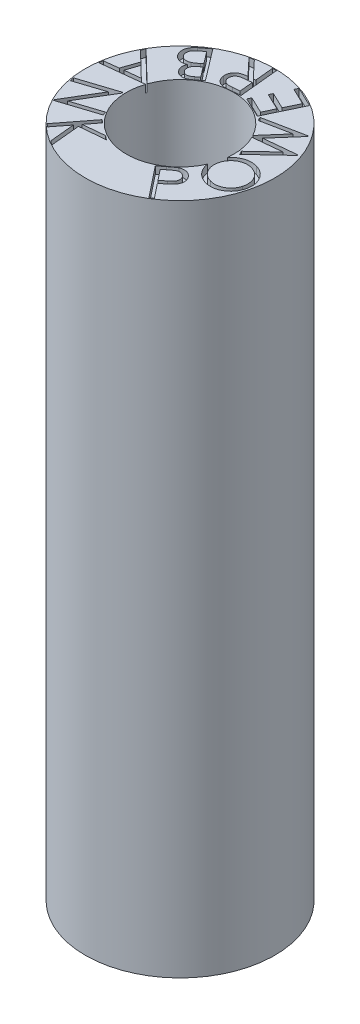
from build123d import *

# Parameters (mm, degrees)
SKETCH1_R           = 3.8
SKETCH1_R_2         = 2.15
BOSS_EXTRUDE1_DEPTH = 27
CUT_EXTRUDE1_DEPTH  = 0.3


with BuildPart() as part:
    # Sketch1 → Boss-Extrude1 (new body)
    with BuildSketch(Plane(origin=(0, 0, 0), x_dir=(1, 0, 0), z_dir=(0, 1, 0))):
        with Locations(Location((0, 0, 0), (0, 0, 270))):
            Circle(SKETCH1_R)
        with Locations(Location((0, 0, 0), (0, 0, 270))):
            Circle(SKETCH1_R_2, mode=Mode.SUBTRACT)
    extrude(amount=BOSS_EXTRUDE1_DEPTH)

    # Sketch2 → Cut-Extrude1 (cut)
    # profile 1 of 9: a face of its own
    with BuildSketch(Plane(origin=(0, 27, 0), x_dir=(1, 0, 0), z_dir=(0, 1, 0))):
        with BuildLine():
            Line((0.982599904, -1.975870203), (1.230010761, -1.779976773))
            add(Edge.make_bspline(
                [(1.230010761, -1.779976773), (1.247051234, -1.766587183), (1.279729012, -1.740910545), (1.327004922, -1.704612222), (1.370644199, -1.672468555), (1.410264244, -1.644230104), (1.445895741, -1.619720543), (1.478034561, -1.599923074), (1.505861087, -1.583259967), (1.523687275, -1.574647201), (1.531801126, -1.570726973)],
                knots=[0, 0, 0, 0, 1.413883867, 2.711343957, 3.888449571, 4.94965571, 5.885716208, 6.708955534, 7.412362121, 8, 8, 8, 8], degree=3))
            add(Edge.make_bspline(
                [(1.531801126, -1.570726973), (1.542328452, -1.566089426), (1.563168837, -1.556908721), (1.595357915, -1.546523319), (1.627697408, -1.538829943), (1.660129737, -1.533777576), (1.6926634, -1.531089349), (1.725317946, -1.531554419), (1.758191511, -1.534341979), (1.79107691, -1.540045365), (1.823554365, -1.54860258), (1.855140485, -1.560144548), (1.885834692, -1.574362326), (1.915130717, -1.592143045), (1.943627311, -1.612422109), (1.970594397, -1.63624137), (1.996835944, -1.662618737), (2.012985941, -1.682007144), (2.021216691, -1.691888332)],
                knots=[0, 0, 0, 0, 1.00932523, 1.998107322, 2.964163901, 3.924962196, 4.877068583, 5.826305595, 6.788454908, 7.77064651, 8.752529476, 9.732823634, 10.719457675, 11.716915946, 12.737036861, 13.785788324, 14.871540088, 16, 16, 16, 16], degree=3))
            add(Edge.make_bspline(
                [(2.021216691, -1.691888332), (2.028988571, -1.702176572), (2.044260055, -1.722392621), (2.064303432, -1.75377069), (2.081013992, -1.785622358), (2.094674391, -1.817614801), (2.105407903, -1.85002966), (2.112518448, -1.882773675), (2.117296917, -1.915719439), (2.117991836, -1.948865619), (2.116180753, -1.981847305), (2.111345647, -2.014513871), (2.103687557, -2.04675535), (2.09308674, -2.07863779), (2.079841435, -2.110259274), (2.062957927, -2.14103182), (2.044090823, -2.171769674), (2.029338133, -2.191174536), (2.021852709, -2.201020443)],
                knots=[0, 0, 0, 0, 1.115566439, 2.192050712, 3.217897653, 4.224908718, 5.199646254, 6.167799991, 7.121371145, 8.075824419, 9.031467262, 9.977240287, 10.929575101, 11.895596865, 12.882134228, 13.891774298, 14.930299329, 16, 16, 16, 16], degree=3))
            add(Edge.make_bspline(
                [(2.021852709, -2.201020443), (2.015364222, -2.208833028), (2.001159455, -2.225936546), (1.976086303, -2.252028454), (1.946704976, -2.281835345), (1.911253074, -2.313686567), (1.871542258, -2.349399542), (1.82606825, -2.387422746), (1.775868896, -2.428823), (1.74045305, -2.457170234), (1.721970397, -2.471963953)],
                knots=[0, 0, 0, 0, 0.601907002, 1.31771065, 2.144265435, 3.082768872, 4.142231728, 5.310615985, 6.596477089, 8, 8, 8, 8], degree=3))
            Line((1.721970397, -2.471963953), (1.633245938, -2.542243901))
            Line((1.633245938, -2.542243901), (2.09117863, -3.120065916))
            Line((2.09117863, -3.120065916), (1.967155193, -3.218330639))
            Line((1.967155193, -3.218330639), (0.982599904, -1.975870203))
        make_face()
        with BuildLine():
            Line((1.202025986, -1.99813082), (1.536889267, -2.420764534))
            Line((1.536889267, -2.420764534), (1.749637164, -2.256353977))
            add(Edge.make_bspline(
                [(1.749637164, -2.256353977), (1.759872858, -2.248157073), (1.779613722, -2.232348283), (1.807185936, -2.208350426), (1.832543606, -2.185803693), (1.855065385, -2.164074316), (1.874570833, -2.142931176), (1.891342989, -2.122911204), (1.906022819, -2.104215579), (1.920948975, -2.08021305), (1.935997936, -2.050442628), (1.946987383, -2.013147228), (1.952675768, -1.97501122), (1.951846399, -1.936278338), (1.945541681, -1.89793025), (1.933713057, -1.860878749), (1.915981135, -1.825815336), (1.900567234, -1.804482486), (1.89274113, -1.793651152)],
                knots=[0, 0, 0, 0, 1.139873163, 2.198393126, 3.177215439, 4.089579485, 4.917780684, 5.676465855, 6.360265572, 6.981531816, 8.131381771, 9.247958655, 10.346594315, 11.471015432, 12.601199469, 13.714463005, 14.839563645, 16, 16, 16, 16], degree=3))
            add(Edge.make_bspline(
                [(1.89274113, -1.793651152), (1.884210815, -1.783745089), (1.867318286, -1.764128175), (1.837435845, -1.739439859), (1.804149627, -1.719926418), (1.768538757, -1.705049855), (1.731478098, -1.695536256), (1.694050164, -1.691447377), (1.656822077, -1.693885321), (1.625835629, -1.700463996), (1.600661562, -1.709467365), (1.5797867, -1.718293668), (1.557770839, -1.730493714), (1.533380631, -1.743782888), (1.508102005, -1.760764586), (1.480632105, -1.779457231), (1.451459367, -1.800631122), (1.431888334, -1.816154424), (1.421770076, -1.824179998)],
                knots=[0, 0, 0, 0, 1.163675189, 2.30441857, 3.435417202, 4.591704879, 5.732878559, 6.834692946, 7.932652339, 9.044547579, 9.645144927, 10.313819024, 11.061881929, 11.886891351, 12.788369302, 13.773726171, 14.849012606, 16, 16, 16, 16], degree=3))
            Line((1.421770076, -1.824179998), (1.202025986, -1.99813082))
        make_face(mode=Mode.SUBTRACT)
    # profile 2 of 9: a face of its own
    with BuildSketch(Plane(origin=(0, 27, 0), x_dir=(1, 0, 0), z_dir=(0, 1, 0))):
        with BuildLine():
            add(Edge.make_bspline(
                [(1.991625351, -0.545622572), (2.000029357, -0.517572681), (2.016551357, -0.462427514), (2.049527824, -0.383893473), (2.088825292, -0.311007785), (2.134128025, -0.243434975), (2.185945006, -0.181421387), (2.244034803, -0.124953951), (2.308442278, -0.074092273), (2.378336094, -0.029402458), (2.451863405, 0.00901634), (2.527743993, 0.039347343), (2.604997417, 0.061435436), (2.683498362, 0.075734827), (2.763577881, 0.080760678), (2.844849129, 0.078774923), (2.927527378, 0.067842414), (2.982115872, 0.054546574), (3.009889574, 0.047781875)],
                knots=[0, 0, 0, 0, 1.067886113, 2.099429174, 3.101456462, 4.085191214, 5.062785548, 6.044754578, 7.036041568, 8.052094896, 9.06759591, 10.058784797, 11.02840403, 11.995009833, 12.964220099, 13.950908388, 14.957456868, 16, 16, 16, 16], degree=3))
            add(Edge.make_bspline(
                [(3.009889574, 0.047781875), (3.03700362, 0.039736451), (3.090545533, 0.02384921), (3.166523183, -0.009032875), (3.237774605, -0.047505066), (3.303539387, -0.092851789), (3.36397452, -0.144850815), (3.419578162, -0.202834876), (3.469625465, -0.26757456), (3.514074443, -0.337649641), (3.552028479, -0.411507989), (3.582379884, -0.48742697), (3.604951087, -0.564481394), (3.619015248, -0.642940264), (3.624754596, -0.722679083), (3.621967363, -0.803508701), (3.611656875, -0.885568999), (3.598526459, -0.939740034), (3.591845703, -0.967302259)],
                knots=[0, 0, 0, 0, 1.041056618, 2.055766994, 3.043057983, 4.0200634, 4.992100927, 5.975329371, 6.974350292, 8.001309033, 9.028200955, 10.028868942, 11.008843004, 11.980849157, 12.95960101, 13.948034232, 14.955959693, 16, 16, 16, 16], degree=3))
            add(Edge.make_bspline(
                [(3.591845703, -0.967302259), (3.583678808, -0.994728104), (3.567589279, -1.048759522), (3.534688258, -1.125653479), (3.496086636, -1.197555188), (3.450357932, -1.26382278), (3.398920417, -1.325185098), (3.340455785, -1.380756054), (3.275897094, -1.431205555), (3.205835026, -1.475825358), (3.132322539, -1.514241928), (3.056689648, -1.544637056), (2.979947732, -1.566695966), (2.902281685, -1.580803222), (2.823529963, -1.586860363), (2.743745655, -1.584873503), (2.662694395, -1.574876932), (2.609299937, -1.561685653), (2.582167719, -1.554982548)],
                knots=[0, 0, 0, 0, 1.054990574, 2.078427706, 3.079381257, 4.061080641, 5.043519763, 6.028229129, 7.031159441, 8.061766972, 9.088523752, 10.087067861, 11.063675181, 12.029447946, 12.994365175, 13.972341833, 14.969652202, 16, 16, 16, 16], degree=3))
            add(Edge.make_bspline(
                [(2.582167719, -1.554982548), (2.564182401, -1.549686505), (2.528399125, -1.539149591), (2.47638303, -1.519643636), (2.426046305, -1.497514804), (2.378187852, -1.47134727), (2.33141038, -1.443414354), (2.287292204, -1.411173359), (2.244614622, -1.376704061), (2.204249421, -1.339179998), (2.166674551, -1.299148579), (2.131398801, -1.257645643), (2.100071329, -1.213768089), (2.071145417, -1.168693413), (2.046109396, -1.121462251), (2.024204811, -1.072639114), (2.004841822, -1.022338362), (1.989567138, -0.970250311), (1.977055529, -0.91753225), (1.968486773, -0.864382029), (1.963380092, -0.811270579), (1.961780681, -0.758046731), (1.963713606, -0.704825912), (1.969080267, -0.65158414), (1.978274246, -0.598347012), (1.987155684, -0.563273597), (1.991625351, -0.545622572)],
                knots=[0, 0, 0, 0, 1.037223879, 2.0636427, 3.07200055, 4.077162655, 5.080182888, 6.084642962, 7.097902888, 8.114823864, 9.131474103, 10.13490593, 11.126418924, 12.112607806, 13.096718421, 14.081266011, 15.072674885, 16.076723787, 17.082707158, 18.069262339, 19.053372954, 20.033436706, 21.013693544, 21.998380925, 22.992666418, 24, 24, 24, 24], degree=3))
        make_face()
        with BuildLine():
            add(Edge.make_bspline(
                [(2.142361529, -0.578695489), (2.138917172, -0.592758374), (2.132068585, -0.620720318), (2.12463227, -0.663175701), (2.120595632, -0.705917293), (2.119298316, -0.748834937), (2.120913688, -0.791966899), (2.125393292, -0.835305236), (2.132731895, -0.878849248), (2.142820851, -0.922324395), (2.155919662, -0.964939045), (2.171001606, -1.006531245), (2.189294511, -1.046235679), (2.209779385, -1.084503059), (2.232105152, -1.121603234), (2.257931433, -1.156497525), (2.285480471, -1.19038513), (2.315722115, -1.222412629), (2.347977646, -1.252520845), (2.382226676, -1.280300223), (2.418120198, -1.305893437), (2.456219035, -1.328565679), (2.495509696, -1.349914851), (2.537160346, -1.367832461), (2.580340182, -1.383869255), (2.610094135, -1.392552998), (2.625098909, -1.396932167)],
                knots=[0, 0, 0, 0, 0.986307279, 1.961124446, 2.933450286, 3.908882607, 4.884555534, 5.871972775, 6.875268522, 7.891350228, 8.910328257, 9.911177508, 10.90339024, 11.885616924, 12.86787016, 13.850203048, 14.840600441, 15.842022812, 16.84871812, 17.844708724, 18.844645517, 19.849162277, 20.863677045, 21.888855731, 22.935360235, 24, 24, 24, 24], degree=3))
            add(Edge.make_bspline(
                [(2.625098909, -1.396932167), (2.647381534, -1.402333714), (2.691284386, -1.412976235), (2.757671289, -1.421493498), (2.823063639, -1.4234185), (2.887444231, -1.419084756), (2.950772971, -1.407889639), (3.012967024, -1.389835899), (3.074070356, -1.36525046), (3.133502045, -1.334455534), (3.189976722, -1.298703258), (3.241728453, -1.258075213), (3.288405159, -1.213703199), (3.330095937, -1.165515553), (3.36619129, -1.112955313), (3.396997447, -1.056418912), (3.42318061, -0.996018619), (3.435914455, -0.9535644), (3.442381561, -0.932003281)],
                knots=[0, 0, 0, 0, 1.050771129, 2.070305873, 3.06234356, 4.046586185, 5.023951091, 6.005453226, 7.010986874, 8.039290383, 9.07085151, 10.071438491, 11.051314355, 12.019839642, 12.98792571, 13.969018521, 14.968530496, 16, 16, 16, 16], degree=3))
            add(Edge.make_bspline(
                [(3.442381561, -0.932003281), (3.446032457, -0.917304195), (3.453267363, -0.888175321), (3.461366852, -0.84414396), (3.466011743, -0.800135794), (3.468108431, -0.756154586), (3.466578257, -0.71229491), (3.462984573, -0.668493787), (3.455861128, -0.624955062), (3.445962927, -0.581764341), (3.433693096, -0.539344496), (3.41875013, -0.498055531), (3.400819162, -0.458456959), (3.380940317, -0.420153326), (3.358098605, -0.383719043), (3.332910009, -0.34868476), (3.305380681, -0.314934852), (3.274963536, -0.283184774), (3.242797641, -0.253112041), (3.208687664, -0.22522247), (3.172476396, -0.200291973), (3.135146838, -0.176705676), (3.095371903, -0.15666756), (3.054381765, -0.137960971), (3.011433396, -0.122036784), (2.981858228, -0.113576656), (2.966958384, -0.109314479)],
                knots=[0, 0, 0, 0, 1.02870095, 2.03855539, 3.038088597, 4.032707763, 5.026805504, 6.017062342, 7.016180482, 8.020577878, 9.025491356, 10.014097524, 11.000367087, 11.976278497, 12.943330417, 13.918497749, 14.905923179, 15.899107766, 16.902782203, 17.895784059, 18.888577038, 19.887695178, 20.89247966, 21.910923103, 22.947531944, 24, 24, 24, 24], degree=3))
            add(Edge.make_bspline(
                [(2.966958384, -0.109314479), (2.951947292, -0.10552321), (2.922315677, -0.098039316), (2.877478259, -0.090154278), (2.833097776, -0.084900467), (2.7889954, -0.083208188), (2.745335781, -0.083624096), (2.702055312, -0.087420672), (2.659217929, -0.094693577), (2.616768971, -0.104017919), (2.575081808, -0.116390193), (2.534742039, -0.13182531), (2.495332139, -0.149302838), (2.457182213, -0.169549178), (2.420554529, -0.193083258), (2.384888635, -0.218638895), (2.350833066, -0.2472927), (2.317768125, -0.277727466), (2.287351526, -0.310891332), (2.258357392, -0.344747321), (2.232703571, -0.38055563), (2.209405974, -0.417488035), (2.188588176, -0.455796396), (2.170637796, -0.495509243), (2.154726629, -0.536413121), (2.146504241, -0.564529514), (2.142361529, -0.578695489)],
                knots=[0, 0, 0, 0, 1.055413227, 2.083366083, 3.101898403, 4.100329543, 5.090695658, 6.077547342, 7.059090479, 8.051643504, 9.039606358, 10.020963176, 10.994864818, 11.977897238, 12.962469754, 13.961554788, 14.967544972, 15.995497828, 17.023450684, 18.034078404, 19.033163438, 20.023846031, 21.010300565, 22.003327224, 22.994009817, 24, 24, 24, 24], degree=3))
        make_face(mode=Mode.SUBTRACT)
    # profile 3 of 9: a face of its own
    with BuildSketch(Plane(origin=(0, 27, 0), x_dir=(1, 0, 0), z_dir=(0, 1, 0))):
        Polygon((2.27424535, 0.115541608), (2.199513278, 0.2595996), (3.062907209, 1.068932032), (1.843025398, 0.947452665), (1.828078983, 0.976073458), (2.633277301, 1.897981011), (1.471273094, 1.66488055), (1.39717704, 1.807984516), (3.009163719, 2.132671515), (3.022838098, 2.105958775), (2.176616644, 1.139847998), (3.458510173, 1.265461479), (3.472502561, 1.238748739), align=None)
    # profile 4 of 9: a face of its own
    with BuildSketch(Plane(origin=(0, 27, 0), x_dir=(1, 0, 0), z_dir=(0, 1, 0))):
        Polygon((1.301422849, 1.795635619), (0.488910329, 2.184878408), (0.55569218, 2.324802286), (1.226690778, 2.003295375), (1.439120666, 2.446599662), (0.773846227, 2.765244494), (0.840310069, 2.903896337), (1.505584508, 2.585251505), (1.772075894, 3.141448921), (1.106801455, 3.460093752), (1.173901315, 3.600017631), (1.980689676, 3.213636922), align=None)
    # profile 5 of 9: a face of its own
    with BuildSketch(Plane(origin=(0, 27, 0), x_dir=(1, 0, 0), z_dir=(0, 1, 0))):
        with BuildLine():
            Line((0.256054447, 2.189451149), (-0.05845627, 2.159240311))
            add(Edge.make_bspline(
                [(-0.05845627, 2.159240311), (-0.079544801, 2.157257518), (-0.119898659, 2.153463353), (-0.177800801, 2.149204328), (-0.230352051, 2.145304325), (-0.277771643, 2.143795127), (-0.320062307, 2.142028123), (-0.357178554, 2.14259876), (-0.389038708, 2.143457747), (-0.408379723, 2.145563083), (-0.417170212, 2.146519959)],
                knots=[0, 0, 0, 0, 1.414142958, 2.706026452, 3.876381837, 4.931762058, 5.873475607, 6.701556143, 7.409857397, 8, 8, 8, 8], degree=3))
            add(Edge.make_bspline(
                [(-0.417170212, 2.146519959), (-0.428969513, 2.148360913), (-0.452204304, 2.15198606), (-0.486134782, 2.160358811), (-0.518625537, 2.171078357), (-0.549574941, 2.18462309), (-0.579332527, 2.200186887), (-0.607672551, 2.218331378), (-0.634496419, 2.239079734), (-0.659464107, 2.262304079), (-0.682761265, 2.287317284), (-0.703550085, 2.314392131), (-0.721324836, 2.343495954), (-0.736649512, 2.374282009), (-0.749761465, 2.406639231), (-0.759977215, 2.440919812), (-0.767220104, 2.477040936), (-0.770219867, 2.501817621), (-0.77175004, 2.514456157)],
                knots=[0, 0, 0, 0, 1.0323829, 2.032933993, 3.018591072, 3.987609034, 4.951278431, 5.920166292, 6.893856332, 7.879939641, 8.86602295, 9.846979274, 10.826520974, 11.810471285, 12.818261775, 13.842102474, 14.899260941, 16, 16, 16, 16], degree=3))
            add(Edge.make_bspline(
                [(-0.77175004, 2.514456157), (-0.773079018, 2.53544478), (-0.775668157, 2.57633518), (-0.769631376, 2.63662407), (-0.756081318, 2.693652279), (-0.73429861, 2.747171055), (-0.70488299, 2.796351428), (-0.668403437, 2.840752518), (-0.624336115, 2.879183282), (-0.582525822, 2.906711718), (-0.545195291, 2.925962604), (-0.513993627, 2.939370853), (-0.479747685, 2.950914509), (-0.442873868, 2.961819384), (-0.403047972, 2.971248923), (-0.360526221, 2.979555275), (-0.315070988, 2.986114006), (-0.28382855, 2.98964647), (-0.26770607, 2.991469378)],
                knots=[0, 0, 0, 0, 1.277757329, 2.489348895, 3.670344165, 4.833239091, 5.990163471, 7.144568493, 8.31429276, 9.534214924, 10.180336012, 10.867964698, 11.598131506, 12.37772245, 13.206776199, 14.087098475, 15.012858157, 16, 16, 16, 16], degree=3))
            Line((-0.26770607, 2.991469378), (-0.90594976, 3.671372222))
            Line((-0.90594976, 3.671372222), (-0.710692348, 3.690134742))
            Line((-0.710692348, 3.690134742), (-0.073402684, 3.010231898))
            Line((-0.073402684, 3.010231898), (0.016911819, 3.019136145))
            Line((0.016911819, 3.019136145), (-0.053686138, 3.753418496))
            Line((-0.053686138, 3.753418496), (0.104046234, 3.768364911))
            Line((0.104046234, 3.768364911), (0.256054447, 2.189451149))
        make_face()
        with BuildLine():
            Line((0.083375661, 2.329057018), (0.031858233, 2.865855896))
            Line((0.031858233, 2.865855896), (-0.240039303, 2.841687226))
            add(Edge.make_bspline(
                [(-0.240039303, 2.841687226), (-0.252768685, 2.840384453), (-0.277310657, 2.837872734), (-0.312716218, 2.83301846), (-0.345550649, 2.827823979), (-0.375692955, 2.821248798), (-0.403403373, 2.814865834), (-0.428378915, 2.807222302), (-0.450503272, 2.798633752), (-0.476343469, 2.786952974), (-0.504865129, 2.769568314), (-0.534836838, 2.744538031), (-0.560310271, 2.715307181), (-0.580523496, 2.682090723), (-0.595861459, 2.646316695), (-0.60523749, 2.608633447), (-0.61019935, 2.569678218), (-0.608514422, 2.543402196), (-0.607657492, 2.530038589)],
                knots=[0, 0, 0, 0, 1.117569786, 2.154650176, 3.121219888, 4.020097284, 4.848756641, 5.604365246, 6.299030225, 6.920481635, 8.079658492, 9.203500793, 10.319266467, 11.449915272, 12.586651313, 13.704987924, 14.832789842, 16, 16, 16, 16], degree=3))
            add(Edge.make_bspline(
                [(-0.607657492, 2.530038589), (-0.605956779, 2.517120892), (-0.60259401, 2.491579121), (-0.59025015, 2.455103676), (-0.573856537, 2.420574573), (-0.551715788, 2.389301684), (-0.525975333, 2.361407548), (-0.496579468, 2.338115859), (-0.464274513, 2.319902969), (-0.43485406, 2.308862848), (-0.408985658, 2.302438023), (-0.386496947, 2.299234957), (-0.361258796, 2.296594635), (-0.333332937, 2.295421473), (-0.302575228, 2.295571015), (-0.26905649, 2.29642911), (-0.23269706, 2.298796574), (-0.207598649, 2.300922296), (-0.194564042, 2.302026269)],
                knots=[0, 0, 0, 0, 1.159246882, 2.292143801, 3.416649949, 4.557288627, 5.694239844, 6.791073478, 7.887296006, 8.98807327, 9.581840358, 10.260960452, 11.011511311, 11.844172728, 12.751593703, 13.753938893, 14.833530805, 16, 16, 16, 16], degree=3))
            Line((-0.194564042, 2.302026269), (0.083375661, 2.329057018))
        make_face(mode=Mode.SUBTRACT)
    # profile 6 of 9: a face of its own
    with BuildSketch(Plane(origin=(0, 27, 0), x_dir=(1, 0, 0), z_dir=(0, 1, 0))):
        with BuildLine():
            Line((-0.969720371, 1.985847912), (-1.217449237, 1.797268685))
            add(Edge.make_bspline(
                [(-1.217449237, 1.797268685), (-1.229705269, 1.788203749), (-1.253474487, 1.770623307), (-1.288783394, 1.745897543), (-1.323038259, 1.724389682), (-1.355933218, 1.705518877), (-1.387347699, 1.689168169), (-1.417516441, 1.675795621), (-1.446402692, 1.665135443), (-1.482752766, 1.654607945), (-1.527472842, 1.647214345), (-1.580837317, 1.646148483), (-1.633603793, 1.653213558), (-1.685081378, 1.668269673), (-1.734127903, 1.69041423), (-1.779127312, 1.71980801), (-1.820712714, 1.754806126), (-1.843711471, 1.782980504), (-1.855374918, 1.797268685)],
                knots=[0, 0, 0, 0, 1.010632805, 1.960010575, 2.856905371, 3.6910918, 4.473716387, 5.203674972, 5.877336505, 6.513480752, 7.710404592, 8.870151813, 10.039969142, 11.225387519, 12.414196528, 13.593537457, 14.779601425, 16, 16, 16, 16], degree=3))
            add(Edge.make_bspline(
                [(-1.855374918, 1.797268685), (-1.865317574, 1.8113313), (-1.884961832, 1.839115588), (-1.907111374, 1.884634272), (-1.923053361, 1.931958262), (-1.931914482, 1.981117646), (-1.933916724, 2.031672296), (-1.928213713, 2.082768093), (-1.915960664, 2.134494191), (-1.901984607, 2.16760254), (-1.894808011, 2.18460342)],
                knots=[0, 0, 0, 0, 1.006543515, 1.988683871, 2.949951783, 3.92097901, 4.901864634, 5.900038059, 6.921685884, 8, 8, 8, 8], degree=3))
            add(Edge.make_bspline(
                [(-1.894808011, 2.18460342), (-1.914551896, 2.178395612), (-1.952232869, 2.166548083), (-2.007351836, 2.153849324), (-2.058061657, 2.14728474), (-2.10483389, 2.146338648), (-2.1486261, 2.151467844), (-2.190760046, 2.160601981), (-2.231752072, 2.174498302), (-2.271445315, 2.19243487), (-2.309049286, 2.215155328), (-2.344293999, 2.242056814), (-2.376861601, 2.273207926), (-2.395916235, 2.296749208), (-2.405530167, 2.308626858)],
                knots=[0, 0, 0, 0, 1.314646262, 2.508987019, 3.588241582, 4.558131185, 5.472910032, 6.383091034, 7.292474374, 8.217704795, 9.145163008, 10.077279822, 11.02989998, 12, 12, 12, 12], degree=3))
            add(Edge.make_bspline(
                [(-2.405530167, 2.308626858), (-2.414697933, 2.321277946), (-2.432697739, 2.346116837), (-2.454880345, 2.385973737), (-2.471885284, 2.427185277), (-2.485206768, 2.469246984), (-2.493517929, 2.512569635), (-2.496915764, 2.55703881), (-2.495870907, 2.602718581), (-2.49057695, 2.649184253), (-2.480393451, 2.695543616), (-2.465510937, 2.74095055), (-2.445154917, 2.7847281), (-2.420301312, 2.82715596), (-2.390519296, 2.868003925), (-2.35594912, 2.907179956), (-2.316640555, 2.945017884), (-2.287539978, 2.968096881), (-2.272602483, 2.979943464)],
                knots=[0, 0, 0, 0, 0.977376015, 1.918960334, 2.846885494, 3.7640249, 4.676254633, 5.601447556, 6.550507009, 7.53239977, 8.524152529, 9.51663751, 10.517185592, 11.540252006, 12.590080322, 13.676187051, 14.8071733, 16, 16, 16, 16], degree=3))
            Line((-2.272602483, 2.979943464), (-1.92724491, 3.242936754))
            Line((-1.92724491, 3.242936754), (-0.969720371, 1.985847912))
        make_face()
        with BuildLine():
            Line((-1.186602382, 2.015104722), (-1.49284487, 2.417385872))
            Line((-1.49284487, 2.417385872), (-1.564714862, 2.362688356))
            add(Edge.make_bspline(
                [(-1.564714862, 2.362688356), (-1.575145884, 2.354579089), (-1.595328712, 2.338888588), (-1.623893809, 2.315278268), (-1.65014962, 2.29299676), (-1.672880385, 2.270827258), (-1.693499931, 2.250185067), (-1.711392042, 2.230244124), (-1.726249141, 2.210916793), (-1.742467467, 2.186863232), (-1.757724396, 2.156411779), (-1.770831548, 2.118923503), (-1.777484187, 2.080146767), (-1.778407726, 2.040943022), (-1.77372424, 2.001998822), (-1.763085072, 1.964638395), (-1.747202688, 1.928921374), (-1.73225278, 1.907610093), (-1.724673296, 1.896805444)],
                knots=[0, 0, 0, 0, 1.134723086, 2.195558805, 3.18310674, 4.091062343, 4.921582124, 5.689021822, 6.390137319, 7.013854197, 8.178392746, 9.30416816, 10.413327146, 11.542631415, 12.661760236, 13.76856253, 14.868678951, 16, 16, 16, 16], degree=3))
            add(Edge.make_bspline(
                [(-1.724673296, 1.896805444), (-1.719226912, 1.889864942), (-1.708588959, 1.876308657), (-1.690078622, 1.859027041), (-1.671462853, 1.843327191), (-1.651194595, 1.830983398), (-1.630096326, 1.821044146), (-1.608038694, 1.813547836), (-1.584902799, 1.809357664), (-1.560947226, 1.806795658), (-1.535863421, 1.808075803), (-1.509673675, 1.811721956), (-1.482480748, 1.819380154), (-1.454194578, 1.829905509), (-1.424785405, 1.843638708), (-1.394751389, 1.861058814), (-1.363268026, 1.881086627), (-1.342647228, 1.896453066), (-1.33193241, 1.904437655)],
                knots=[0, 0, 0, 0, 0.946940395, 1.849577245, 2.716324517, 3.560683201, 4.391631747, 5.220467808, 6.056324723, 6.91471634, 7.804237721, 8.748637649, 9.752106048, 10.833797001, 11.991063313, 13.236326505, 14.563961607, 16, 16, 16, 16], degree=3))
            Line((-1.33193241, 1.904437655), (-1.186602382, 2.015104722))
        make_face(mode=Mode.SUBTRACT)
        with BuildLine():
            Line((-1.589201541, 2.54395338), (-1.956501721, 3.026054742))
            Line((-1.956501721, 3.026054742), (-2.112008031, 2.907755464))
            add(Edge.make_bspline(
                [(-2.112008031, 2.907755464), (-2.123085298, 2.899236827), (-2.14442687, 2.882824736), (-2.174495431, 2.857953544), (-2.201345699, 2.833770596), (-2.225801978, 2.810927099), (-2.246944479, 2.788769413), (-2.265377775, 2.767678563), (-2.280655418, 2.74735593), (-2.297116256, 2.721737559), (-2.312886087, 2.689259057), (-2.325761421, 2.648875741), (-2.332476841, 2.607077843), (-2.333077704, 2.564558566), (-2.32770832, 2.522714782), (-2.316872757, 2.482571281), (-2.300024863, 2.444872181), (-2.284320555, 2.422355471), (-2.276418588, 2.411025696)],
                knots=[0, 0, 0, 0, 1.132192609, 2.181293671, 3.160606163, 4.059768676, 4.891997176, 5.640998395, 6.328103067, 6.949947032, 8.106155053, 9.241568238, 10.372587456, 11.523615967, 12.675221129, 13.779542848, 14.882728398, 16, 16, 16, 16], degree=3))
            add(Edge.make_bspline(
                [(-2.276418588, 2.411025696), (-2.26540516, 2.397982139), (-2.243794727, 2.372388211), (-2.204091322, 2.341625117), (-2.159490361, 2.319066711), (-2.110534643, 2.304942619), (-2.058490106, 2.298689058), (-2.004599653, 2.302360353), (-1.949292507, 2.314092954), (-1.913597043, 2.328513527), (-1.89512602, 2.335975616)],
                knots=[0, 0, 0, 0, 0.970622972, 1.904546049, 2.839152453, 3.802399607, 4.793570585, 5.810071312, 6.866796515, 8, 8, 8, 8], degree=3))
            add(Edge.make_bspline(
                [(-1.89512602, 2.335975616), (-1.888301946, 2.339074827), (-1.873572324, 2.345764411), (-1.850733869, 2.358366388), (-1.825377676, 2.37369027), (-1.797280787, 2.391612834), (-1.76651925, 2.412120715), (-1.733509306, 2.435948347), (-1.697472161, 2.461850681), (-1.672900677, 2.48050506), (-1.660117507, 2.490209891)],
                knots=[0, 0, 0, 0, 0.638510283, 1.378211056, 2.220994746, 3.163255557, 4.218051197, 5.371089891, 6.632324915, 8, 8, 8, 8], degree=3))
            Line((-1.660117507, 2.490209891), (-1.589201541, 2.54395338))
        make_face(mode=Mode.SUBTRACT)
    # profile 7 of 9: a face of its own
    with BuildSketch(Plane(origin=(0, 27, 0), x_dir=(1, 0, 0), z_dir=(0, 1, 0))):
        Polygon((-2.032865755, 0.663541611), (-3.759335607, 0.472736323), (-3.704956099, 0.633012765), (-3.135084304, 0.701066651), (-2.917566276, 1.343762465), (-3.32938769, 1.742863526), (-3.27310013, 1.909182136), (-2.020463411, 0.699794616), align=None)
        Polygon((-2.342924349, 0.788519075), (-2.796404917, 1.228325265), (-2.969083704, 0.718239127), align=None, mode=Mode.SUBTRACT)
    # profile 8 of 9: a face of its own
    with BuildSketch(Plane(origin=(0, 27, 0), x_dir=(1, 0, 0), z_dir=(0, 1, 0))):
        Polygon((-3.721556065, -0.560231846), (-2.215784331, -0.070816281), (-2.204972031, -0.103571189), (-3.032430965, -1.479277319), (-1.879649014, -1.104662936), (-1.831311674, -1.253173052), (-3.337083409, -1.742588617), (-3.348213718, -1.708879683), (-2.532839118, -0.346211914), (-3.670992664, -0.716056165), align=None)
    # profile 9 of 9: a face of its own
    with BuildSketch(Plane(origin=(0, 27, 0), x_dir=(1, 0, 0), z_dir=(0, 1, 0))):
        Polygon((-1.691078349, -1.437357681), (-1.564192832, -1.535622404), (-1.925768854, -2.001823326), (-1.068417091, -1.92041307), (-0.900190428, -2.050796683), (-1.929902969, -2.144927292), (-1.817645857, -3.329192116), (-1.982374423, -3.201352573), (-2.078413085, -2.198670782), (-2.528077548, -2.778082841), (-2.654963065, -2.679818118), align=None)
    extrude(amount=-CUT_EXTRUDE1_DEPTH, mode=Mode.SUBTRACT)


solid = part.part
